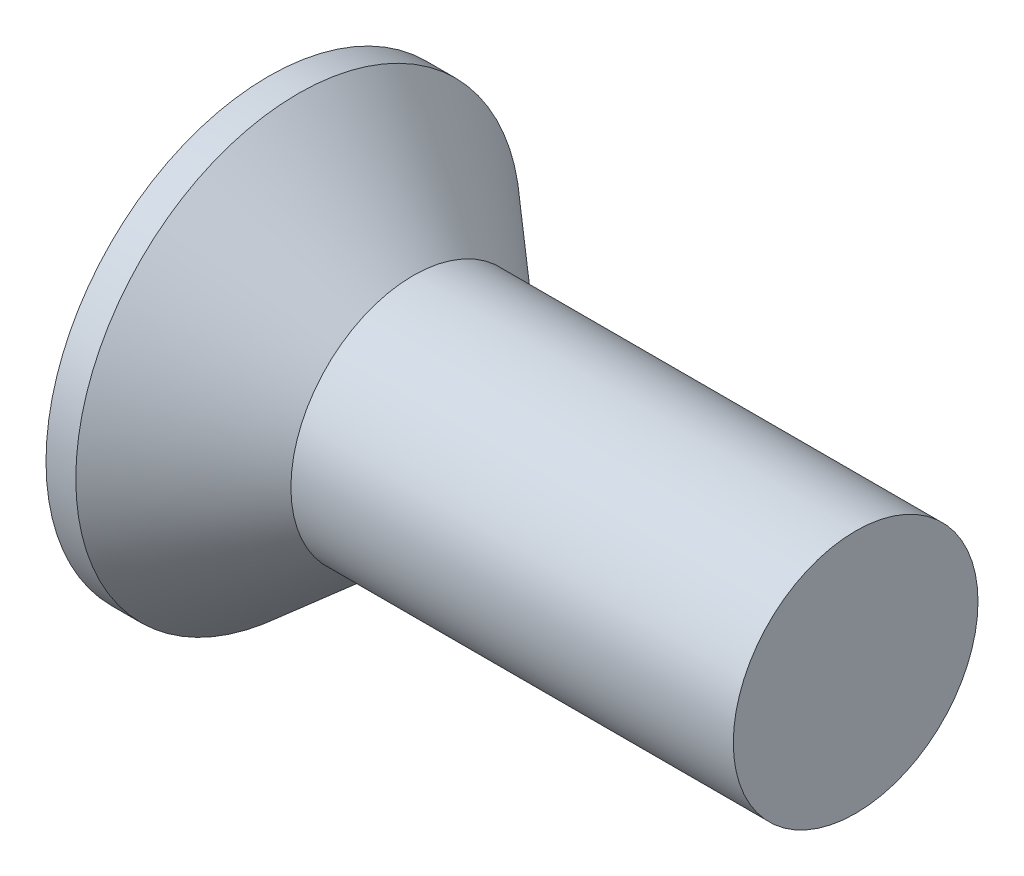
from build123d import *

# Parameters (mm, degrees)
CIRPATTERN1_COUNT = 2
CIRPATTERN1_ANGLE = 90


with BuildPart() as part:
    # BodySke → Base-Revolve (revolve)
    with BuildSketch(Plane.XY, mode=Mode.PRIVATE) as base_revolve_sk:
        Polygon((0, 0), (0, 7.2136), (0.966227074, 7.2136), (4.699, 3.96875), (19.05, 3.96875), (19.05, 0), align=None)
    revolve(base_revolve_sk.sketch.rotate(Axis((-6.35, 0, 0), (1, 0, 0)), 90), axis=Axis((-6.35, 0, 0), (1, 0, 0)))

    # Sketch3 → Cross section 0
    with BuildSketch(Plane.ZY):
        with BuildLine():
            Line((-0.9398, 5.6388), (0.9398, 5.6388))
            Line((0.9398, 5.6388), (0.9398, -5.6388))
            Line((0.9398, -5.6388), (-0.9398, -5.6388))
            Line((-0.9398, -5.6388), (-0.9398, 5.6388))
        make_face()
    # Sketch4 → Cross section 1
    with BuildSketch(Plane.ZY.offset(-6.6548)):
        with BuildLine():
            Line((-0.4699, 0.4699), (0.4699, 0.4699))
            Line((0.4699, 0.4699), (0.4699, -0.4699))
            Line((0.4699, -0.4699), (-0.4699, -0.4699))
            Line((-0.4699, -0.4699), (-0.4699, 0.4699))
        make_face()
    cross = loft(mode=Mode.SUBTRACT)

    # CirPattern1: Cross ×2 about axis
    cirpattern1_axis = Axis((0, 0, 0), (1, 0, 0))
    for i in range(1, CIRPATTERN1_COUNT):
        add(cross.rotate(cirpattern1_axis, i * CIRPATTERN1_ANGLE / (CIRPATTERN1_COUNT - 1)), mode=Mode.SUBTRACT)


solid = part.part
